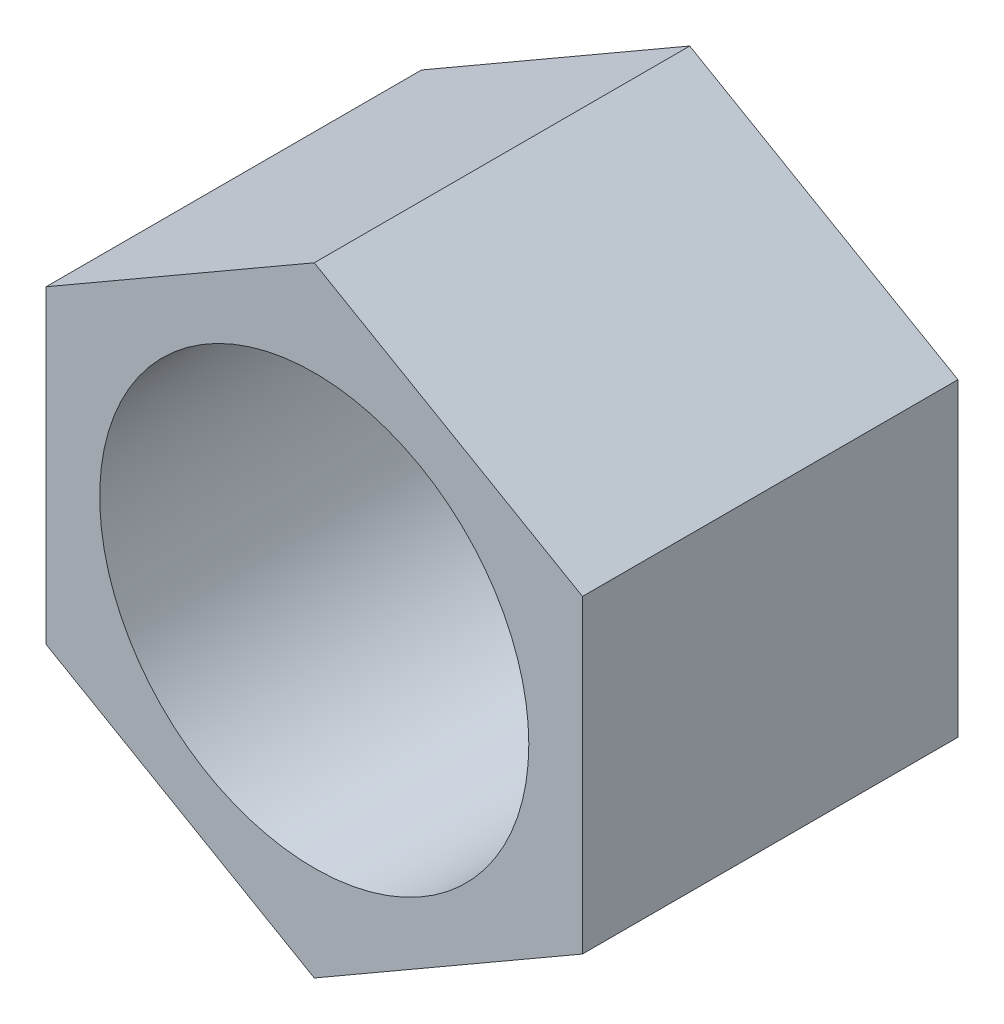
from build123d import *

# Parameters (mm, degrees)
SKETCH1_R           = 2
BOSS_EXTRUDE1_DEPTH = 3.5


with BuildPart() as part:
    # Sketch1 → Boss-Extrude1 (new body)
    with BuildSketch(Plane.XY.offset(13.5)):
        Polygon((-22.5, 18.556624327), (-20, 17.113248654), (-17.5, 18.556624327), (-17.5, 21.443375673), (-20, 22.886751346), (-22.5, 21.443375673), align=None)
        with Locations((-20, 20)):
            Circle(SKETCH1_R, mode=Mode.SUBTRACT)
    extrude(amount=-BOSS_EXTRUDE1_DEPTH)


solid = part.part
